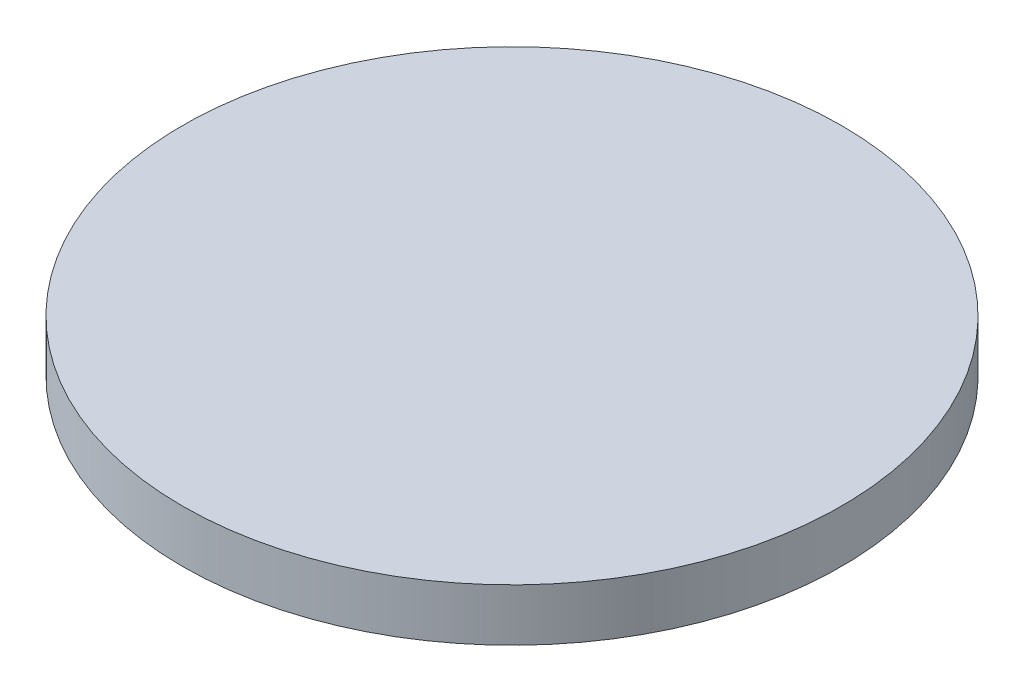
from build123d import *

# Parameters (mm, degrees)
SKETCH1_R           = 40
BOSS_EXTRUDE1_DEPTH = 6.35


with BuildPart() as part:
    # Sketch1 → Boss-Extrude1 (new body)
    with BuildSketch(Plane(origin=(0, 0, 0), x_dir=(1, 0, 0), z_dir=(0, 1, 0))):
        with Locations(Location((0, 0, 0), (0, 0, 270))):
            Circle(SKETCH1_R)
    extrude(amount=BOSS_EXTRUDE1_DEPTH)


solid = part.part
